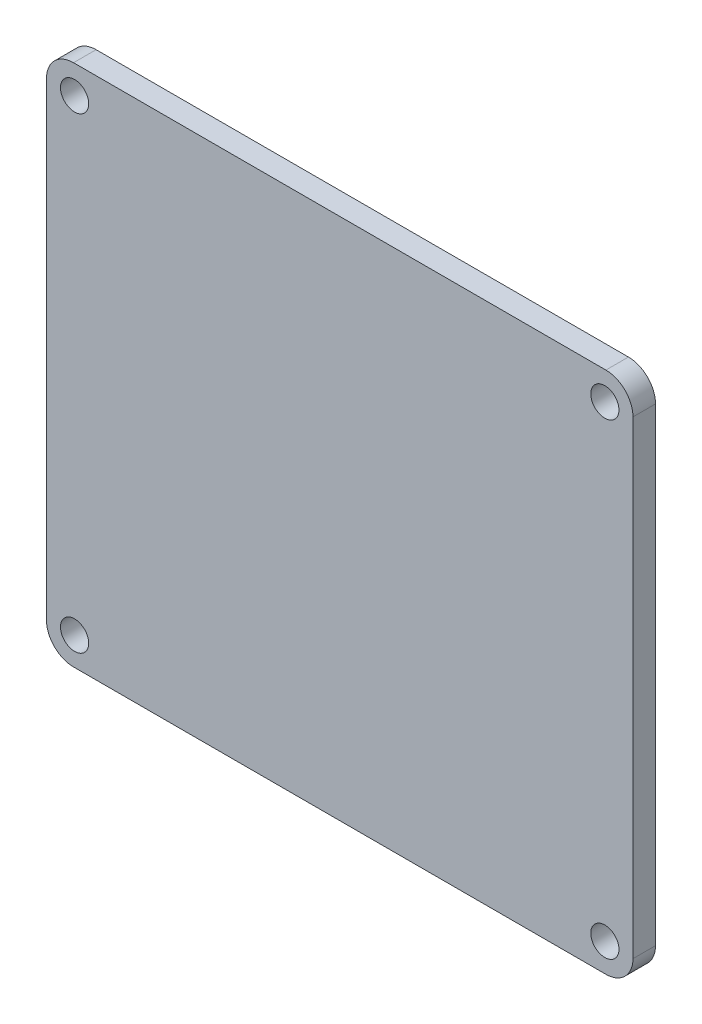
from build123d import *

# Parameters (mm, degrees)
BASE_SKETCH_W       = 65
BASE_SKETCH_H       = 58
BOSS_EXTRUDE2_DEPTH = 2.5
MOUNTING_HOLES_R    = 1.56250005
MOUNTING_HOLES_R_2  = 1.5625
CUT_EXTRUDE5_DEPTH  = 2.5
FILLET1_R           = 3


with BuildPart() as part:
    # Base Sketch → Boss-Extrude2 (new body)
    with BuildSketch(Plane.XY):
        with Locations((32.5, 29)):
            Rectangle(BASE_SKETCH_W, BASE_SKETCH_H)
    extrude(amount=BOSS_EXTRUDE2_DEPTH)

    # Mounting Holes → Cut-Extrude5 (cut)
    with BuildSketch(Plane.XY):
        with Locations((3.115503651, 54.884496349)):
            Circle(MOUNTING_HOLES_R)
        with Locations((61.884496349, 54.884496349)):
            Circle(MOUNTING_HOLES_R)
        with Locations((61.884496349, 3.115503651)):
            Circle(MOUNTING_HOLES_R)
        with Locations((3.115503651, 3.115503651)):
            Circle(MOUNTING_HOLES_R_2)
    extrude(amount=CUT_EXTRUDE5_DEPTH, mode=Mode.SUBTRACT)

    # Fillet1
    fillet1_edges = [part.edges().sort_by_distance(p)[0] for p in [
        (0, 0, 1.25),
        (0, 58, 1.25),
        (65, 58, 1.25),
        (65, 0, 1.25),
    ]]
    fillet(fillet1_edges, radius=FILLET1_R)


solid = part.part
